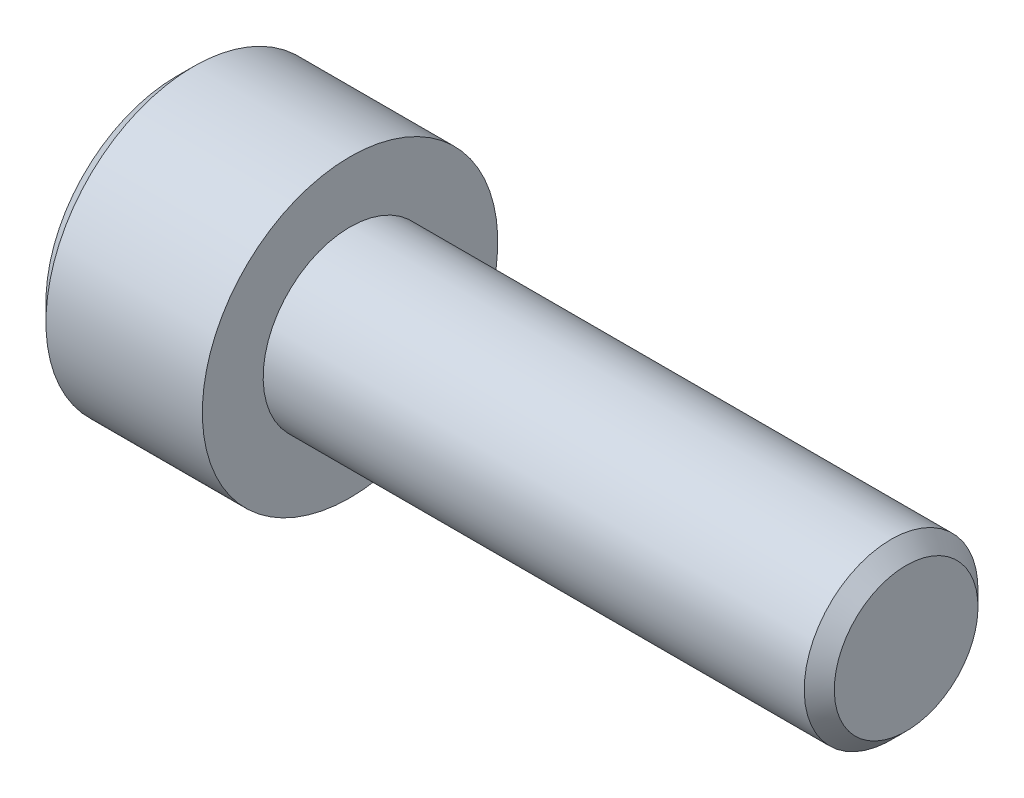
from build123d import *

# Parameters (mm, degrees)
CUT_EXTRUDE1_DEPTH = 2.5


with BuildPart() as part:
    # Sketch1 → Revolve1 (revolve)
    with BuildSketch(Plane.XY):
        Polygon((0, 2.5), (0, 4.25), (-4.5, 4.25), (-5, 3.75), (-5, 0), (16, 0), (16, 2.067), (15.567, 2.5), align=None)
    revolve(axis=Axis((16, 0, 0), (-1, 0, 0)))

    # Sketch2 → Cut-Extrude1 (cut)
    with BuildSketch(Plane.ZY.offset(5)):
        Polygon((0, 2.309401077), (-2, 1.154700538), (-2, -1.154700538), (0, -2.309401077), (2, -1.154700538), (2, 1.154700538), align=None)
    extrude(amount=-CUT_EXTRUDE1_DEPTH, mode=Mode.SUBTRACT)


solid = part.part
